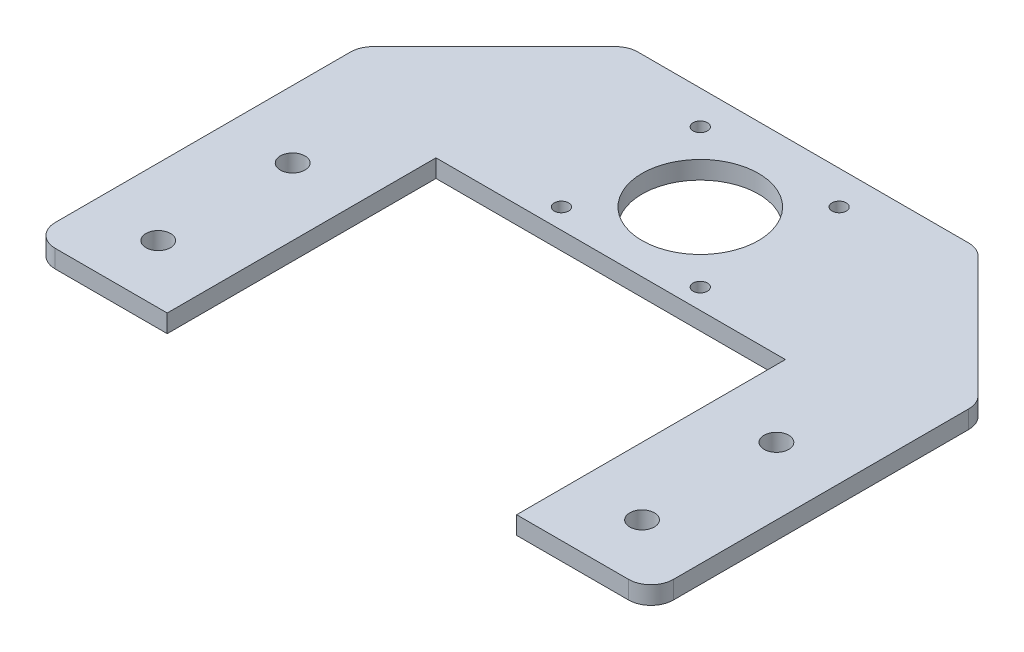
from build123d import *

# Parameters (mm, degrees)
SKETCH1_R                = 13
BOSS_EXTRUDE1_DEPTH      = 4
CHAMFER1_SIZE            = 30
M3_CLEARANCE_HOLE1_D     = 3.2
M3_CLEARANCE_HOLE1_DEPTH = 8
M3_CLEARANCE_HOLE1_TIP   = 0.96137699
FILLET1_R                = 5
M5_CLEARANCE_HOLE1_D     = 5.5
M5_CLEARANCE_HOLE1_DEPTH = 8
M5_CLEARANCE_HOLE1_TIP   = 1.652366702


with BuildPart() as part:
    # Sketch1 → Boss-Extrude1 (new body)
    with BuildSketch(Plane(origin=(0, 0, 0), x_dir=(1, 0, 0), z_dir=(0, 1, 0))):
        Polygon((-69, -60), (-69, 43), (69, 43), (69, -60), (39, -60), (39, 0), (-39, 0), (-39, -60), align=None)
        with Locations(Location((0, 20, 0), (0, 0, 270))):
            Circle(SKETCH1_R, mode=Mode.SUBTRACT)
    extrude(amount=BOSS_EXTRUDE1_DEPTH)

    # Chamfer1
    chamfer1_edges = [part.edges().sort_by_distance(p)[0] for p in [
        (-69, 2, -43),
        (69, 2, -43),
    ]]
    chamfer(chamfer1_edges, length=CHAMFER1_SIZE)

    # M3 Clearance Hole1
    with Locations(Plane(origin=(0, 4, 0), x_dir=(1, 0, 0), z_dir=(0, 1, 0))):
        with Locations((-15.5, 35.5), (-15.5, 4.5), (15.5, 4.5), (15.5, 35.5)):
            Hole(M3_CLEARANCE_HOLE1_D / 2, depth=M3_CLEARANCE_HOLE1_DEPTH)
            with Locations((0, 0, -(M3_CLEARANCE_HOLE1_DEPTH + M3_CLEARANCE_HOLE1_TIP / 2))):  # 118° drill point
                Cone(0, M3_CLEARANCE_HOLE1_D / 2, M3_CLEARANCE_HOLE1_TIP, mode=Mode.SUBTRACT)

    # Fillet1
    fillet1_edges = [part.edges().sort_by_distance(p)[0] for p in [
        (-69, 2, 60),
        (69, 2, 60),
        (-69, 2, -13),
        (39, 2, -43),
        (-39, 2, -43),
        (69, 2, -13),
    ]]
    fillet(fillet1_edges, radius=FILLET1_R)

    # M5 Clearance Hole1
    with Locations(Plane(origin=(0, 4, 0), x_dir=(1, 0, 0), z_dir=(0, 1, 0))):
        with Locations((-54, -47), (-54, -17), (54, -17), (54, -47)):
            Hole(M5_CLEARANCE_HOLE1_D / 2, depth=M5_CLEARANCE_HOLE1_DEPTH)
            with Locations((0, 0, -(M5_CLEARANCE_HOLE1_DEPTH + M5_CLEARANCE_HOLE1_TIP / 2))):  # 118° drill point
                Cone(0, M5_CLEARANCE_HOLE1_D / 2, M5_CLEARANCE_HOLE1_TIP, mode=Mode.SUBTRACT)


solid = part.part
